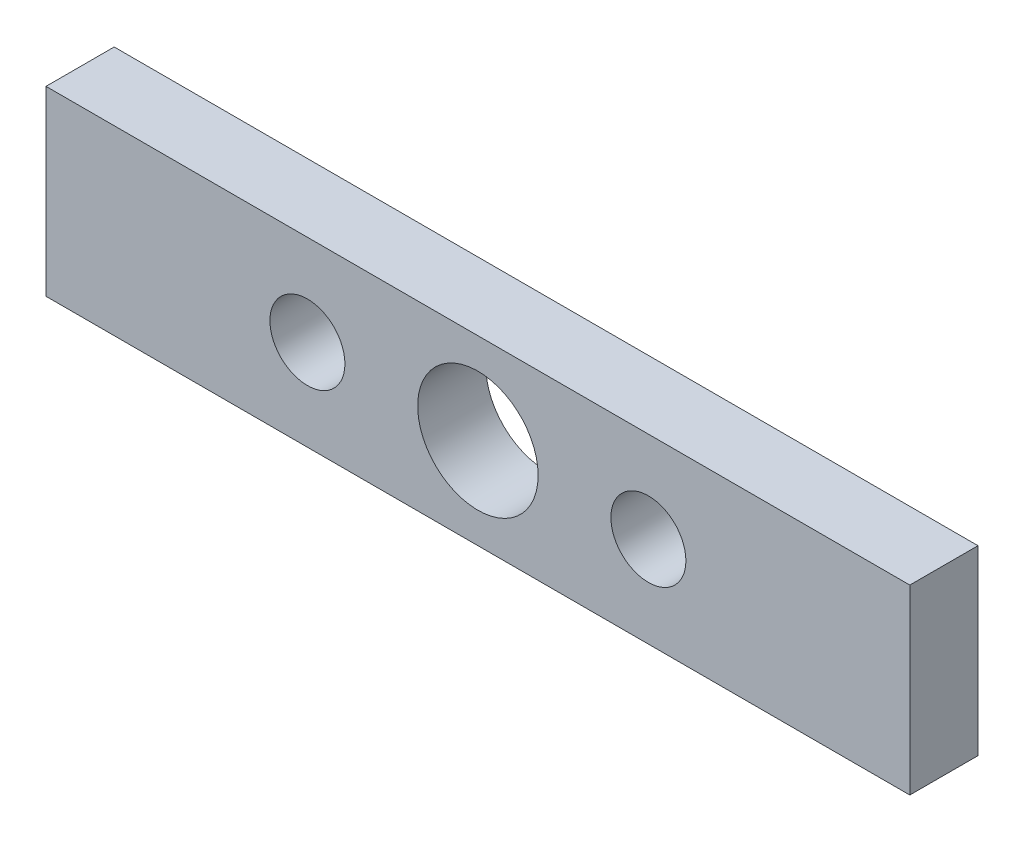
from build123d import *

# Parameters (mm, degrees)
SKETCH1_W           = 38
SKETCH1_H           = 8
BOSS_EXTRUDE1_DEPTH = 3
SKETCH2_R           = 2.65
SKETCH2_R_2         = 1.65
CUT_EXTRUDE1_DEPTH  = 21.832666656


with BuildPart() as part:
    # Sketch1 → Boss-Extrude1 (new body)
    with BuildSketch(Plane.XY):
        with Locations((0, 4)):
            Rectangle(SKETCH1_W, SKETCH1_H)
    extrude(amount=BOSS_EXTRUDE1_DEPTH)

    # Sketch2 → Cut-Extrude1 (cut, through all)
    with BuildSketch(Plane.XY.offset(3)):
        with Locations((0, 4)):
            Circle(SKETCH2_R)
        with Locations((-7.5, 4)):
            Circle(SKETCH2_R_2)
        with Locations((7.5, 4)):
            Circle(SKETCH2_R_2)
    extrude(amount=-CUT_EXTRUDE1_DEPTH, mode=Mode.SUBTRACT)


solid = part.part
